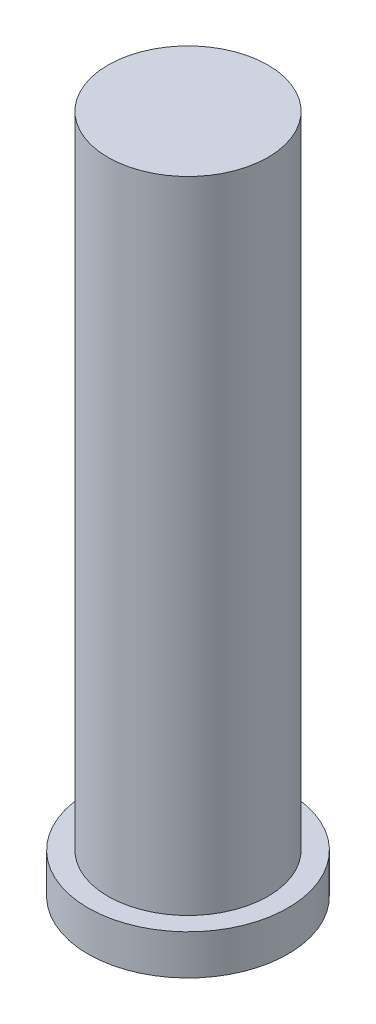
from build123d import *

# Parameters (mm, degrees)
SKETCH2_R           = 1
BOSS_EXTRUDE1_DEPTH = 8
SKETCH2_3_R         = 1.25
BOSS_EXTRUDE2_DEPTH = 0.5


with BuildPart() as part:
    # Sketch2 → Boss-Extrude1 (new body)
    with BuildSketch(Plane(origin=(0, 0, 0), x_dir=(1, 0, 0), z_dir=(0, 1, 0))):
        Circle(SKETCH2_R)
    extrude(amount=BOSS_EXTRUDE1_DEPTH)

    # Sketch2<3> → Boss-Extrude2 (add)
    with BuildSketch(Plane(origin=(0, 0, 0), x_dir=(1, 0, 0), z_dir=(0, 1, 0))):
        Circle(SKETCH2_3_R)
    extrude(amount=-BOSS_EXTRUDE2_DEPTH)


solid = part.part
